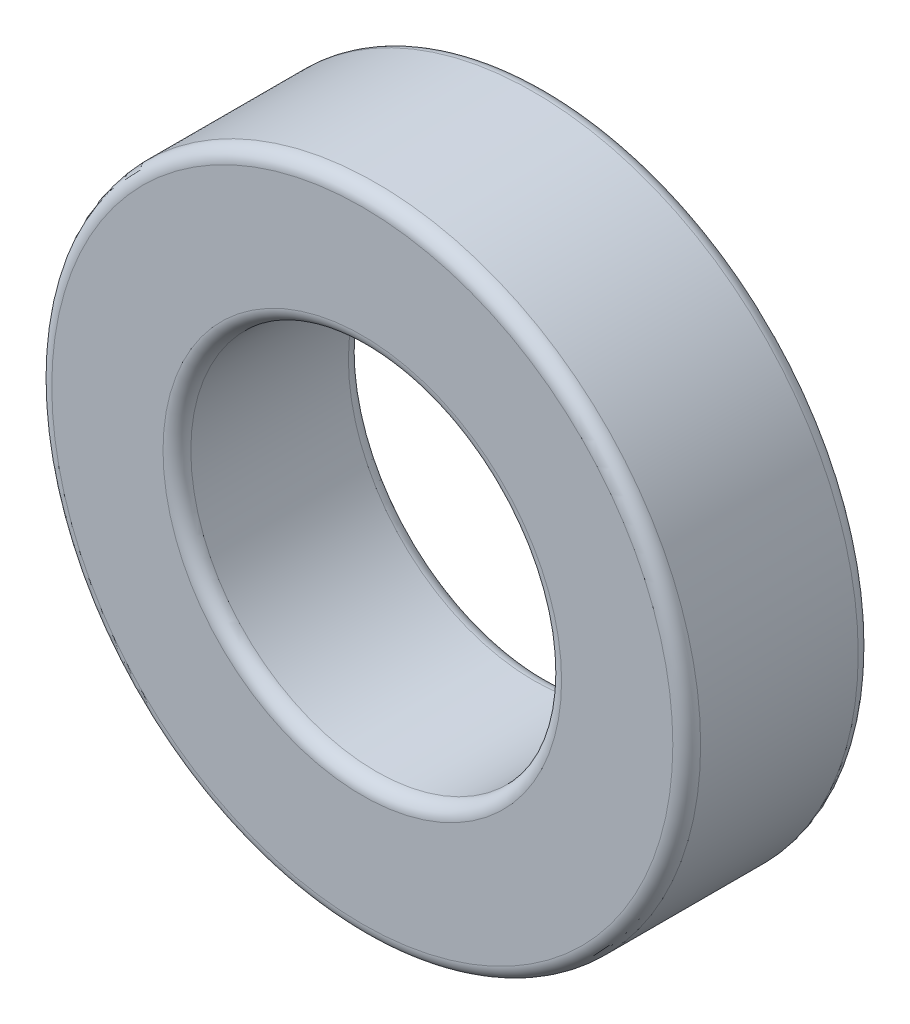
from build123d import *

# Parameters (mm, degrees)
SKETCH_1_R      = 7
SKETCH_1_R_2    = 4
EXTRUDE_1_DEPTH = 4
FILLET_1_R      = 0.3


with BuildPart() as part:
    # 草图1 → 凸台-拉伸1 (new body)
    with BuildSketch(Plane.XY):
        Circle(SKETCH_1_R)
        Circle(SKETCH_1_R_2, mode=Mode.SUBTRACT)
    extrude(amount=EXTRUDE_1_DEPTH)

    # 圆角1
    fillet_1_edges = [part.edges().sort_by_distance(p)[0] for p in [
        (-7, 0, 0),
        (-7, 0, 4),
        (-4, 0, 0),
        (-4, 0, 4),
    ]]
    fillet(fillet_1_edges, radius=FILLET_1_R)


solid = part.part
